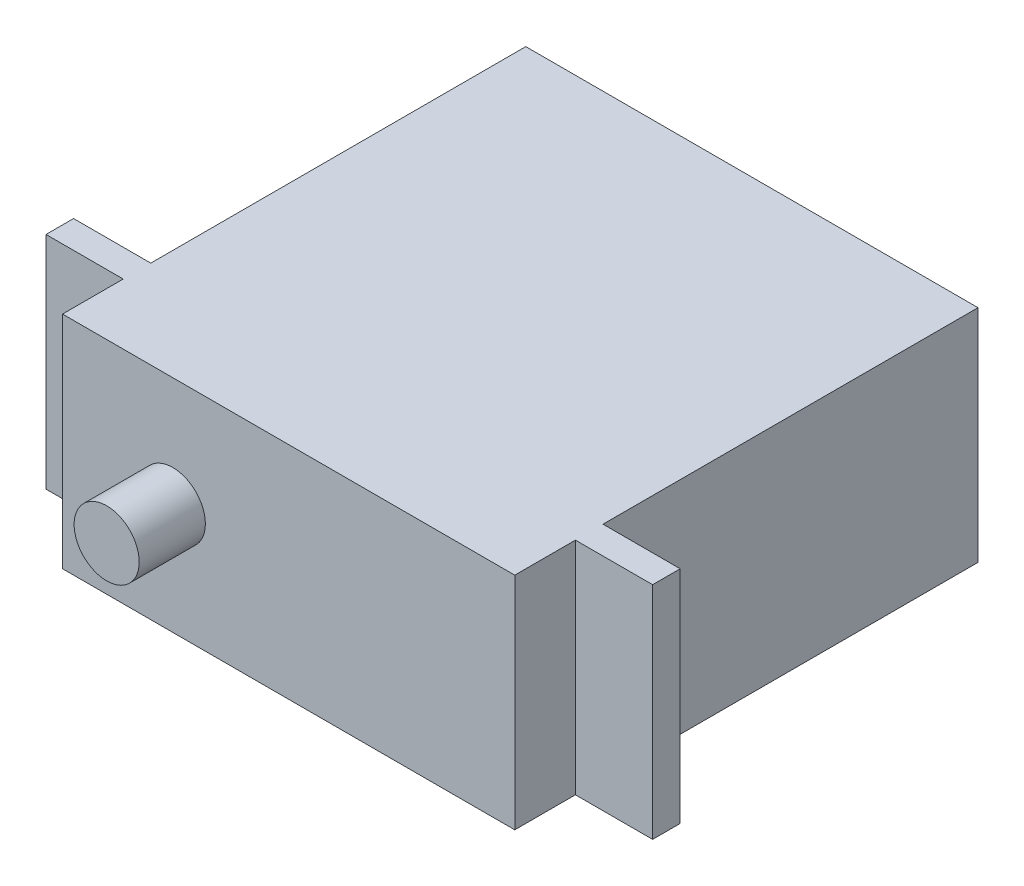
from build123d import *

# Parameters (mm, degrees)
SKETCH_1_W      = 41
SKETCH_1_H      = 20
EXTRUDE_1_DEPTH = 42
SKETCH_3_W      = 2.5
SKETCH_3_H      = 20
EXTRUDE_2_DEPTH = 7
SKETCH_4_W      = 2.5
SKETCH_4_H      = 20
EXTRUDE_3_DEPTH = 7
SKETCH_5_R      = 2.95
EXTRUDE_4_DEPTH = 6


with BuildPart() as part:
    # ｽｹｯﾁ1 → ﾎﾞｽ - 押し出し1 (new body)
    with BuildSketch(Plane.XY):
        with Locations((-24.251560295, -13.435714286)):
            Rectangle(SKETCH_1_W, SKETCH_1_H)
    extrude(amount=EXTRUDE_1_DEPTH)

    # ｽｹｯﾁ3 → ﾎﾞｽ - 押し出し2 (add)
    with BuildSketch(Plane(origin=(-3.751560295, 0, 0), x_dir=(0, 0, -1), z_dir=(1, 0, 0))):
        with Locations((-35.25, -13.435714286)):
            Rectangle(SKETCH_3_W, SKETCH_3_H)
    extrude(amount=EXTRUDE_2_DEPTH)

    # ｽｹｯﾁ4 → ﾎﾞｽ - 押し出し3 (add)
    with BuildSketch(Plane.ZY.offset(44.751560295)):
        with Locations((35.25, -13.435714286)):
            Rectangle(SKETCH_4_W, SKETCH_4_H)
    extrude(amount=EXTRUDE_3_DEPTH)

    # ｽｹｯﾁ5 → ﾎﾞｽ - 押し出し4 (add)
    with BuildSketch(Plane.XY.offset(42)):
        with Locations((-34.751560295, -13.435714286)):
            Circle(SKETCH_5_R)
    extrude(amount=EXTRUDE_4_DEPTH)


solid = part.part
